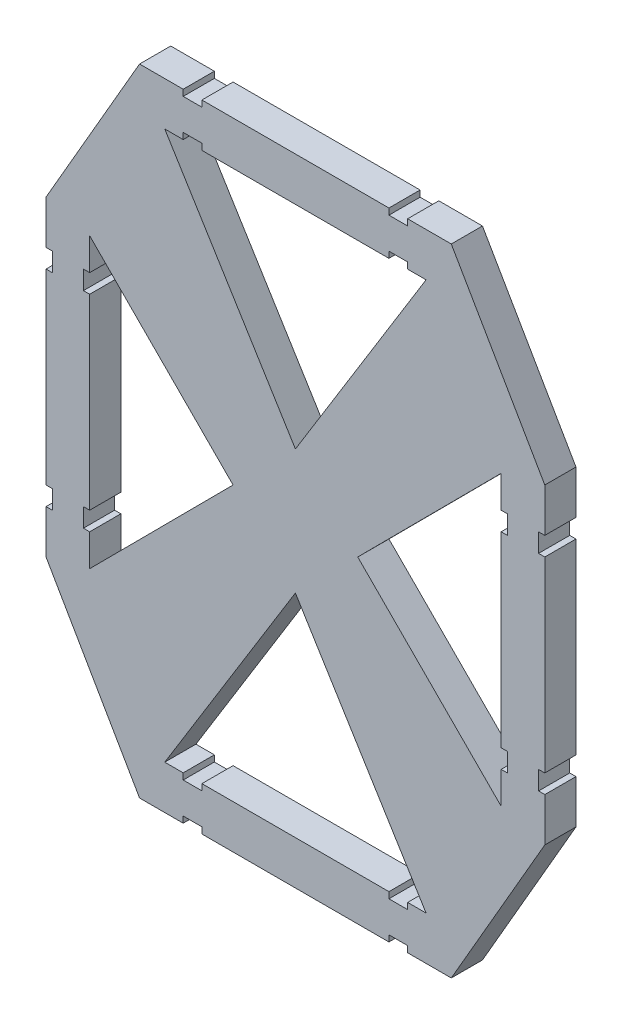
from build123d import *

# Parameters (mm, degrees)
BOSS_EXTRU_4_DEPTH = 5


with BuildPart() as part:
    # Esquisse1 → Boss.-Extru.4 (new body)
    with BuildSketch(Plane.XY):
        Polygon((-275.915909498, -82.850341845), (-268.915909498, -82.850341845), (-268.915909498, -81.850341845), (-265.915909498, -81.850341845), (-265.915909498, -82.850341845), (-235.915909498, -82.850341845), (-235.915909498, -81.850341845), (-232.915909498, -81.850341845), (-232.915909498, -82.850341845), (-225.915909498, -82.850341845), (-210.915909498, -56.869579731), (-210.915909498, -49.869579731), (-211.915909498, -49.869579731), (-211.915909498, -46.869579731), (-210.915909498, -46.869579731), (-210.915909498, -16.869579731), (-211.915909498, -16.869579731), (-211.915909498, -13.869579731), (-210.915909498, -13.869579731), (-210.915909498, -6.869579731), (-225.915909498, 19.111182382), (-232.915909498, 19.111182382), (-232.915909498, 18.111182382), (-235.915909498, 18.111182382), (-235.915909498, 19.111182382), (-265.915909498, 19.111182382), (-265.915909498, 18.111182382), (-268.915909498, 18.111182382), (-268.915909498, 19.111182382), (-275.915909498, 19.111182382), (-290.915909498, -6.869579731), (-290.915909498, -13.869579731), (-289.915909498, -13.869579731), (-289.915909498, -16.869579731), (-290.915909498, -16.869579731), (-290.915909498, -46.869579731), (-289.915909498, -46.869579731), (-289.915909498, -49.869579731), (-290.915909498, -49.869579731), (-290.915909498, -56.869579731), align=None)
        Polygon((-283.915909498, -49.869579731), (-283.915909498, -54.993935384), (-260.915909498, -31.869817618), (-283.915909498, -8.745224078), (-283.915909498, -13.869579731), (-284.915909498, -13.869579731), (-284.915909498, -16.869579731), (-283.915909498, -16.869579731), (-283.915909498, -46.869579731), (-284.915909498, -46.869579731), (-284.915909498, -49.869579731), align=None, mode=Mode.SUBTRACT)
        Polygon((-268.915909498, 12.111182382), (-271.874457613, 12.111182382), (-250.915909498, -21.869817618), (-229.957361382, 12.111182382), (-232.915909498, 12.111182382), (-232.915909498, 13.111182382), (-235.915909498, 13.111182382), (-235.915909498, 12.111182382), (-265.915909498, 12.111182382), (-265.915909498, 13.111182382), (-268.915909498, 13.111182382), align=None, mode=Mode.SUBTRACT)
        Polygon((-271.874457613, -75.850341845), (-250.915909498, -41.869817618), (-229.957361382, -75.850341845), (-232.915909498, -75.850341845), (-232.915909498, -76.850341845), (-235.915909498, -76.850341845), (-235.915909498, -75.850341845), (-265.915909498, -75.850341845), (-265.915909498, -76.850341845), (-268.915909498, -76.850341845), (-268.915909498, -75.850341845), align=None, mode=Mode.SUBTRACT)
        Polygon((-217.915909498, -54.993935384), (-240.915909498, -31.869817618), (-217.915909498, -8.745224078), (-217.915909498, -13.869579731), (-216.915909498, -13.869579731), (-216.915909498, -16.869579731), (-217.915909498, -16.869579731), (-217.915909498, -46.869579731), (-216.915909498, -46.869579731), (-216.915909498, -49.869579731), (-217.915909498, -49.869579731), align=None, mode=Mode.SUBTRACT)
    extrude(amount=BOSS_EXTRU_4_DEPTH)


solid = part.part
